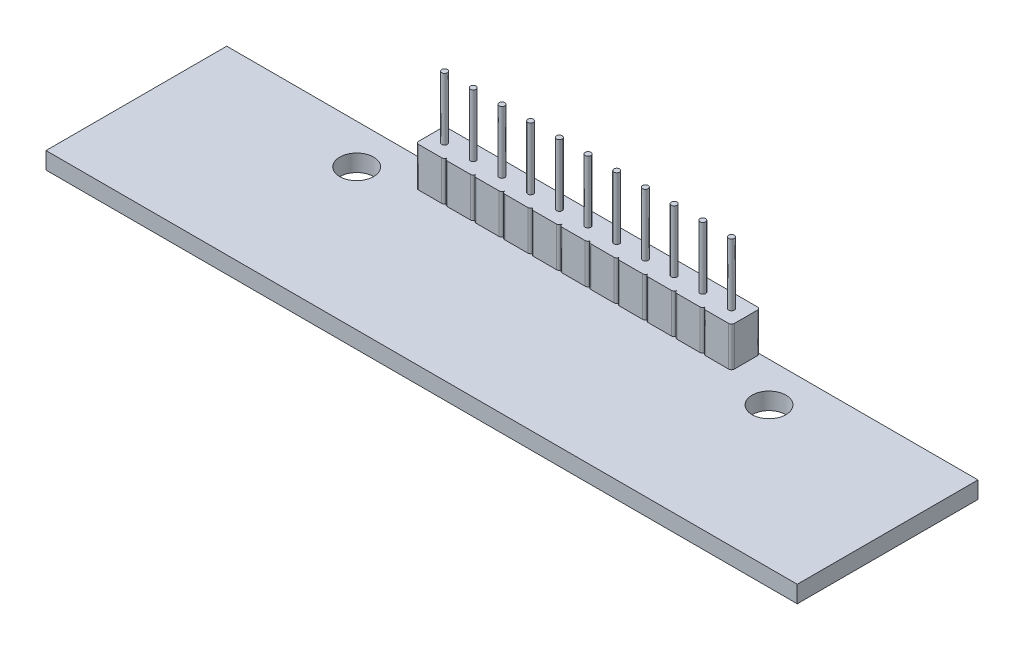
from build123d import *

# Parameters (mm, degrees)
SKETCH1_W              = 66.5
SKETCH1_H              = 16
BOSS_EXTRUDE1_DEPTH    = 1.5
SKETCH2_R              = 1.5
CUT_EXTRUDE1_DEPTH     = 35.231746961
SKETCH3_W              = 2.8
SKETCH3_H              = 3.3
BOSS_EXTRUDE2_DEPTH    = 1.5
BOSS_EXTRUDE2_2_DEPTH  = 1.5
BOSS_EXTRUDE2_3_DEPTH  = 1.5
BOSS_EXTRUDE2_4_DEPTH  = 1.5
BOSS_EXTRUDE2_5_DEPTH  = 1.5
BOSS_EXTRUDE2_6_DEPTH  = 1.5
BOSS_EXTRUDE2_7_DEPTH  = 1.5
BOSS_EXTRUDE2_8_DEPTH  = 1.5
BOSS_EXTRUDE3_DEPTH    = 3.5
SKETCH7_R              = 0.25
BOSS_EXTRUDE4_DEPTH    = 5.5
BOSS_EXTRUDE4_2_DEPTH  = 5.5
BOSS_EXTRUDE4_3_DEPTH  = 5.5
BOSS_EXTRUDE4_4_DEPTH  = 5.5
BOSS_EXTRUDE4_5_DEPTH  = 5.5
BOSS_EXTRUDE4_6_DEPTH  = 5.5
BOSS_EXTRUDE4_7_DEPTH  = 5.5
BOSS_EXTRUDE4_8_DEPTH  = 5.5
BOSS_EXTRUDE4_9_DEPTH  = 5.5
BOSS_EXTRUDE4_10_DEPTH = 5.5
BOSS_EXTRUDE4_11_DEPTH = 5.5


with BuildPart() as part:
    # Sketch1 → Boss-Extrude1 (new body)
    with BuildSketch(Plane(origin=(0, 0, 0), x_dir=(1, 0, 0), z_dir=(0, 1, 0))):
        Rectangle(SKETCH1_W, SKETCH1_H)
    extrude(amount=BOSS_EXTRUDE1_DEPTH)

    # Sketch2 → Cut-Extrude1 (cut, through all)
    with BuildSketch(Plane(origin=(0, 1.5, 0), x_dir=(1, 0, 0), z_dir=(0, 1, 0))):
        with Locations(Location((-18.25, 4.5, 0), (0, 0, 270))):
            Circle(SKETCH2_R)
        with Locations(Location((18.25, 4.5, 0), (0, 0, 270))):
            Circle(SKETCH2_R)
    extrude(amount=-CUT_EXTRUDE1_DEPTH, mode=Mode.SUBTRACT)


with BuildPart() as body_2:
    # Sketch3 → Boss-Extrude2 (new body)
    with BuildSketch(Plane.XZ):
        with Locations((-27.85, 4.65)):
            Rectangle(SKETCH3_W, SKETCH3_H)
    extrude(amount=BOSS_EXTRUDE2_DEPTH)


with BuildPart() as body_3:
    # Sketch3 → Boss-Extrude2 2 (new body)
    with BuildSketch(Plane.XZ):
        with Locations((-19.892857143, 4.65)):
            Rectangle(SKETCH3_W, SKETCH3_H)
    extrude(amount=BOSS_EXTRUDE2_2_DEPTH)


with BuildPart() as body_4:
    # Sketch3 → Boss-Extrude2 3 (new body)
    with BuildSketch(Plane.XZ):
        with Locations((-11.935714286, 4.65)):
            Rectangle(SKETCH3_W, SKETCH3_H)
    extrude(amount=BOSS_EXTRUDE2_3_DEPTH)


with BuildPart() as body_5:
    # Sketch3 → Boss-Extrude2 4 (new body)
    with BuildSketch(Plane.XZ):
        with Locations((-3.978571429, 4.65)):
            Rectangle(SKETCH3_W, SKETCH3_H)
    extrude(amount=BOSS_EXTRUDE2_4_DEPTH)


with BuildPart() as body_6:
    # Sketch3 → Boss-Extrude2 5 (new body)
    with BuildSketch(Plane.XZ):
        with Locations((3.978571429, 4.65)):
            Rectangle(SKETCH3_W, SKETCH3_H)
    extrude(amount=BOSS_EXTRUDE2_5_DEPTH)


with BuildPart() as body_7:
    # Sketch3 → Boss-Extrude2 6 (new body)
    with BuildSketch(Plane.XZ):
        with Locations((11.935714286, 4.65)):
            Rectangle(SKETCH3_W, SKETCH3_H)
    extrude(amount=BOSS_EXTRUDE2_6_DEPTH)


with BuildPart() as body_8:
    # Sketch3 → Boss-Extrude2 7 (new body)
    with BuildSketch(Plane.XZ):
        with Locations((19.892857143, 4.65)):
            Rectangle(SKETCH3_W, SKETCH3_H)
    extrude(amount=BOSS_EXTRUDE2_7_DEPTH)


with BuildPart() as body_9:
    # Sketch3 → Boss-Extrude2 8 (new body)
    with BuildSketch(Plane.XZ):
        with Locations((27.85, 4.65)):
            Rectangle(SKETCH3_W, SKETCH3_H)
    extrude(amount=BOSS_EXTRUDE2_8_DEPTH)


with BuildPart() as body_10:
    # Sketch5 → Boss-Extrude3 (new body)
    with BuildSketch(Plane(origin=(0, 1.5, 0), x_dir=(1, 0, 0), z_dir=(0, 1, 0))):
        with BuildLine():
            Line((-11.43, 5.71), (-11.43, 7.75))
            ThreePointArc((-11.43, 7.75), (-11.503223305, 7.926776695), (-11.68, 8))
            Line((-11.68, 8), (-13.72, 8))
            ThreePointArc((-13.72, 8), (-13.896776695, 7.926776695), (-13.97, 7.75))
            Line((-13.97, 7.75), (-13.97, 5.71))
            ThreePointArc((-13.97, 5.71), (-13.896776695, 5.533223305), (-13.72, 5.46))
            Line((-13.72, 5.46), (-11.68, 5.46))
            ThreePointArc((-11.68, 5.46), (-11.503223305, 5.533223305), (-11.43, 5.71))
        make_face()
        with BuildLine():
            Line((-8.89, 5.71), (-8.89, 7.75))
            ThreePointArc((-8.89, 7.75), (-8.963223305, 7.926776695), (-9.14, 8))
            Line((-9.14, 8), (-11.18, 8))
            ThreePointArc((-11.18, 8), (-11.356776695, 7.926776695), (-11.43, 7.75))
            Line((-11.43, 7.75), (-11.43, 5.71))
            ThreePointArc((-11.43, 5.71), (-11.356776695, 5.533223305), (-11.18, 5.46))
            Line((-11.18, 5.46), (-9.14, 5.46))
            ThreePointArc((-9.14, 5.46), (-8.963223305, 5.533223305), (-8.89, 5.71))
        make_face()
        with BuildLine():
            Line((-6.35, 5.71), (-6.35, 7.75))
            ThreePointArc((-6.35, 7.75), (-6.423223305, 7.926776695), (-6.6, 8))
            Line((-6.6, 8), (-8.64, 8))
            ThreePointArc((-8.64, 8), (-8.816776695, 7.926776695), (-8.89, 7.75))
            Line((-8.89, 7.75), (-8.89, 5.71))
            ThreePointArc((-8.89, 5.71), (-8.816776695, 5.533223305), (-8.64, 5.46))
            Line((-8.64, 5.46), (-6.6, 5.46))
            ThreePointArc((-6.6, 5.46), (-6.423223305, 5.533223305), (-6.35, 5.71))
        make_face()
        with BuildLine():
            Line((-3.81, 5.71), (-3.81, 7.75))
            ThreePointArc((-3.81, 7.75), (-3.883223305, 7.926776695), (-4.06, 8))
            Line((-4.06, 8), (-6.1, 8))
            ThreePointArc((-6.1, 8), (-6.276776695, 7.926776695), (-6.35, 7.75))
            Line((-6.35, 7.75), (-6.35, 5.71))
            ThreePointArc((-6.35, 5.71), (-6.276776695, 5.533223305), (-6.1, 5.46))
            Line((-6.1, 5.46), (-4.06, 5.46))
            ThreePointArc((-4.06, 5.46), (-3.883223305, 5.533223305), (-3.81, 5.71))
        make_face()
        with BuildLine():
            Line((-1.27, 5.71), (-1.27, 7.75))
            ThreePointArc((-1.27, 7.75), (-1.343223305, 7.926776695), (-1.52, 8))
            Line((-1.52, 8), (-3.56, 8))
            ThreePointArc((-3.56, 8), (-3.736776695, 7.926776695), (-3.81, 7.75))
            Line((-3.81, 7.75), (-3.81, 5.71))
            ThreePointArc((-3.81, 5.71), (-3.736776695, 5.533223305), (-3.56, 5.46))
            Line((-3.56, 5.46), (-1.52, 5.46))
            ThreePointArc((-1.52, 5.46), (-1.343223305, 5.533223305), (-1.27, 5.71))
        make_face()
        with BuildLine():
            Line((1.02, 8), (-1.02, 8))
            ThreePointArc((-1.02, 8), (-1.196776695, 7.926776695), (-1.27, 7.75))
            Line((-1.27, 7.75), (-1.27, 5.71))
            ThreePointArc((-1.27, 5.71), (-1.196776695, 5.533223305), (-1.02, 5.46))
            Line((-1.02, 5.46), (1.02, 5.46))
            ThreePointArc((1.02, 5.46), (1.196776695, 5.533223305), (1.27, 5.71))
            Line((1.27, 5.71), (1.27, 7.75))
            ThreePointArc((1.27, 7.75), (1.196776695, 7.926776695), (1.02, 8))
        make_face()
        with BuildLine():
            ThreePointArc((1.52, 8), (1.343223305, 7.926776695), (1.27, 7.75))
            Line((1.27, 7.75), (1.27, 5.71))
            ThreePointArc((1.27, 5.71), (1.343223305, 5.533223305), (1.52, 5.46))
            Line((1.52, 5.46), (3.56, 5.46))
            ThreePointArc((3.56, 5.46), (3.736776695, 5.533223305), (3.81, 5.71))
            Line((3.81, 5.71), (3.81, 7.75))
            ThreePointArc((3.81, 7.75), (3.736776695, 7.926776695), (3.56, 8))
            Line((3.56, 8), (1.52, 8))
        make_face()
        with BuildLine():
            ThreePointArc((4.06, 8), (3.883223305, 7.926776695), (3.81, 7.75))
            Line((3.81, 7.75), (3.81, 5.71))
            ThreePointArc((3.81, 5.71), (3.883223305, 5.533223305), (4.06, 5.46))
            Line((4.06, 5.46), (6.1, 5.46))
            ThreePointArc((6.1, 5.46), (6.276776695, 5.533223305), (6.35, 5.71))
            Line((6.35, 5.71), (6.35, 7.75))
            ThreePointArc((6.35, 7.75), (6.276776695, 7.926776695), (6.1, 8))
            Line((6.1, 8), (4.06, 8))
        make_face()
        with BuildLine():
            ThreePointArc((6.6, 8), (6.423223305, 7.926776695), (6.35, 7.75))
            Line((6.35, 7.75), (6.35, 5.71))
            ThreePointArc((6.35, 5.71), (6.423223305, 5.533223305), (6.6, 5.46))
            Line((6.6, 5.46), (8.64, 5.46))
            ThreePointArc((8.64, 5.46), (8.816776695, 5.533223305), (8.89, 5.71))
            Line((8.89, 5.71), (8.89, 7.75))
            ThreePointArc((8.89, 7.75), (8.816776695, 7.926776695), (8.64, 8))
            Line((8.64, 8), (6.6, 8))
        make_face()
        with BuildLine():
            ThreePointArc((9.14, 8), (8.963223305, 7.926776695), (8.89, 7.75))
            Line((8.89, 7.75), (8.89, 5.71))
            ThreePointArc((8.89, 5.71), (8.963223305, 5.533223305), (9.14, 5.46))
            Line((9.14, 5.46), (11.18, 5.46))
            ThreePointArc((11.18, 5.46), (11.356776695, 5.533223305), (11.43, 5.71))
            Line((11.43, 5.71), (11.43, 7.75))
            ThreePointArc((11.43, 7.75), (11.356776695, 7.926776695), (11.18, 8))
            Line((11.18, 8), (9.14, 8))
        make_face()
        with BuildLine():
            ThreePointArc((11.68, 8), (11.503223305, 7.926776695), (11.43, 7.75))
            Line((11.43, 7.75), (11.43, 5.71))
            ThreePointArc((11.43, 5.71), (11.503223305, 5.533223305), (11.68, 5.46))
            Line((11.68, 5.46), (13.72, 5.46))
            ThreePointArc((13.72, 5.46), (13.896776695, 5.533223305), (13.97, 5.71))
            Line((13.97, 5.71), (13.97, 7.75))
            ThreePointArc((13.97, 7.75), (13.896776695, 7.926776695), (13.72, 8))
            Line((13.72, 8), (11.68, 8))
        make_face()
    extrude(amount=BOSS_EXTRUDE3_DEPTH)


with BuildPart() as body_11:
    # Sketch7 → Boss-Extrude4 (new body)
    with BuildSketch(Plane(origin=(0, 5, 0), x_dir=(1, 0, 0), z_dir=(0, 1, 0))):
        with Locations(Location((0, 6.73, 0), (0, 0, 270))):
            Circle(SKETCH7_R)
    extrude(amount=BOSS_EXTRUDE4_DEPTH)


with BuildPart() as body_12:
    # Sketch7 → Boss-Extrude4 2 (new body)
    with BuildSketch(Plane(origin=(0, 5, 0), x_dir=(1, 0, 0), z_dir=(0, 1, 0))):
        with Locations(Location((2.54, 6.73, 0), (0, 0, 270))):
            Circle(SKETCH7_R)
    extrude(amount=BOSS_EXTRUDE4_2_DEPTH)


with BuildPart() as body_13:
    # Sketch7 → Boss-Extrude4 3 (new body)
    with BuildSketch(Plane(origin=(0, 5, 0), x_dir=(1, 0, 0), z_dir=(0, 1, 0))):
        with Locations(Location((5.08, 6.73, 0), (0, 0, 270))):
            Circle(SKETCH7_R)
    extrude(amount=BOSS_EXTRUDE4_3_DEPTH)


with BuildPart() as body_14:
    # Sketch7 → Boss-Extrude4 4 (new body)
    with BuildSketch(Plane(origin=(0, 5, 0), x_dir=(1, 0, 0), z_dir=(0, 1, 0))):
        with Locations(Location((7.62, 6.73, 0), (0, 0, 270))):
            Circle(SKETCH7_R)
    extrude(amount=BOSS_EXTRUDE4_4_DEPTH)


with BuildPart() as body_15:
    # Sketch7 → Boss-Extrude4 5 (new body)
    with BuildSketch(Plane(origin=(0, 5, 0), x_dir=(1, 0, 0), z_dir=(0, 1, 0))):
        with Locations(Location((10.16, 6.73, 0), (0, 0, 270))):
            Circle(SKETCH7_R)
    extrude(amount=BOSS_EXTRUDE4_5_DEPTH)


with BuildPart() as body_16:
    # Sketch7 → Boss-Extrude4 6 (new body)
    with BuildSketch(Plane(origin=(0, 5, 0), x_dir=(1, 0, 0), z_dir=(0, 1, 0))):
        with Locations(Location((12.7, 6.73, 0), (0, 0, 270))):
            Circle(SKETCH7_R)
    extrude(amount=BOSS_EXTRUDE4_6_DEPTH)


with BuildPart() as body_17:
    # Sketch7 → Boss-Extrude4 7 (new body)
    with BuildSketch(Plane(origin=(0, 5, 0), x_dir=(1, 0, 0), z_dir=(0, 1, 0))):
        with Locations(Location((-2.54, 6.73, 0), (0, 0, 270))):
            Circle(SKETCH7_R)
    extrude(amount=BOSS_EXTRUDE4_7_DEPTH)


with BuildPart() as body_18:
    # Sketch7 → Boss-Extrude4 8 (new body)
    with BuildSketch(Plane(origin=(0, 5, 0), x_dir=(1, 0, 0), z_dir=(0, 1, 0))):
        with Locations(Location((-5.08, 6.73, 0), (0, 0, 270))):
            Circle(SKETCH7_R)
    extrude(amount=BOSS_EXTRUDE4_8_DEPTH)


with BuildPart() as body_19:
    # Sketch7 → Boss-Extrude4 9 (new body)
    with BuildSketch(Plane(origin=(0, 5, 0), x_dir=(1, 0, 0), z_dir=(0, 1, 0))):
        with Locations(Location((-7.62, 6.73, 0), (0, 0, 270))):
            Circle(SKETCH7_R)
    extrude(amount=BOSS_EXTRUDE4_9_DEPTH)


with BuildPart() as body_20:
    # Sketch7 → Boss-Extrude4 10 (new body)
    with BuildSketch(Plane(origin=(0, 5, 0), x_dir=(1, 0, 0), z_dir=(0, 1, 0))):
        with Locations(Location((-10.16, 6.73, 0), (0, 0, 270))):
            Circle(SKETCH7_R)
    extrude(amount=BOSS_EXTRUDE4_10_DEPTH)


with BuildPart() as body_21:
    # Sketch7 → Boss-Extrude4 11 (new body)
    with BuildSketch(Plane(origin=(0, 5, 0), x_dir=(1, 0, 0), z_dir=(0, 1, 0))):
        with Locations(Location((-12.7, 6.73, 0), (0, 0, 270))):
            Circle(SKETCH7_R)
    extrude(amount=BOSS_EXTRUDE4_11_DEPTH)


solid = Compound([part.part, body_2.part, body_3.part, body_4.part, body_5.part, body_6.part, body_7.part, body_8.part, body_9.part, body_10.part, body_11.part, body_12.part, body_13.part, body_14.part, body_15.part, body_16.part, body_17.part, body_18.part, body_19.part, body_20.part, body_21.part])
